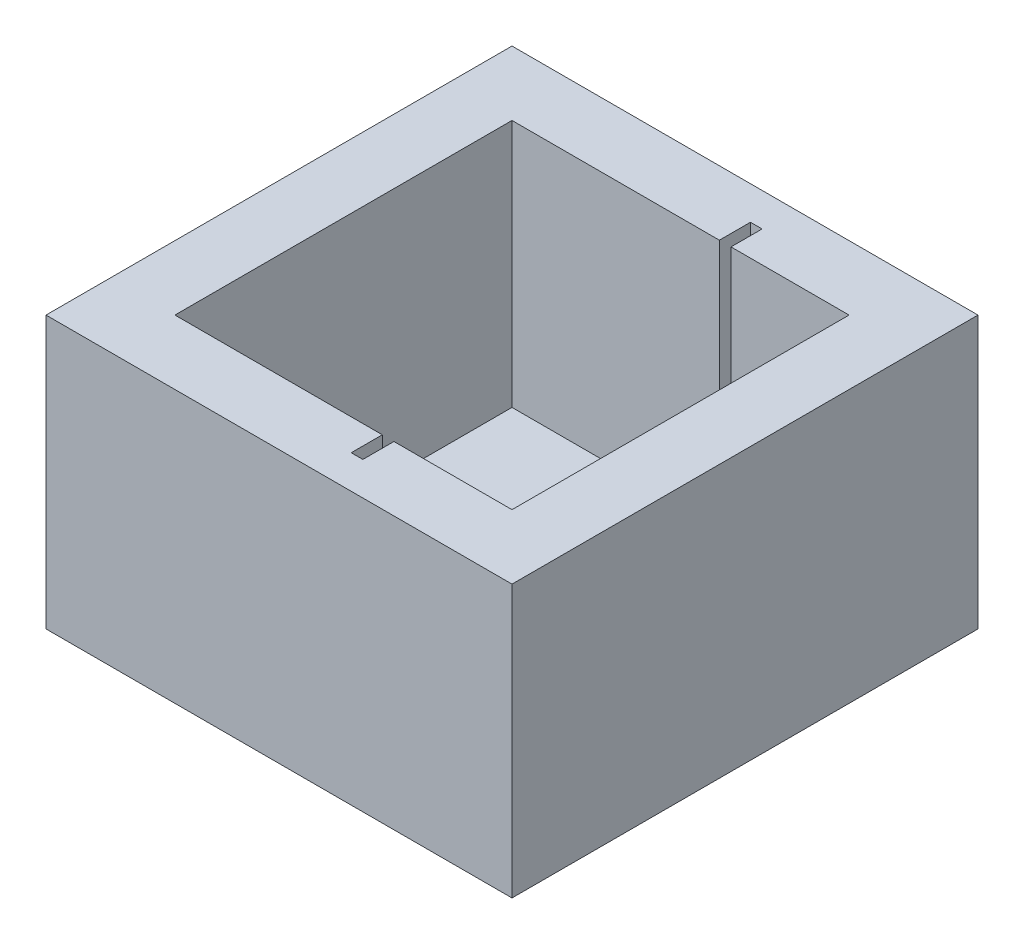
from build123d import *

# Parameters (mm, degrees)
SKETCH1_W           = 60
SKETCH1_H           = 60
BOSS_EXTRUDE1_DEPTH = 35
SKETCH2_W           = 43.4
SKETCH2_H           = 43.4
CUT_EXTRUDE1_DEPTH  = 32
SKETCH3_W           = 1.5
SKETCH3_H           = 4
CUT_EXTRUDE4_DEPTH  = 32
SKETCH7_W           = 3.5
SKETCH7_H           = 3.5
CUT_EXTRUDE7_DEPTH  = 76
BOSS_EXTRUDE4_DEPTH = 8.3
BOSS_EXTRUDE6_DEPTH = 8.3


with BuildPart() as part:
    # Sketch1 → Boss-Extrude1 (new body)
    with BuildSketch(Plane(origin=(0, 0, 0), x_dir=(1, 0, 0), z_dir=(0, 1, 0))):
        with Locations((-4.265402844, -11.303317536)):
            Rectangle(SKETCH1_W, SKETCH1_H)
    extrude(amount=BOSS_EXTRUDE1_DEPTH)

    # Sketch2 → Cut-Extrude1 (cut)
    with BuildSketch(Plane(origin=(0, 35, 0), x_dir=(1, 0, 0), z_dir=(0, 1, 0))):
        with Locations((-4.265402844, -11.303317536)):
            Rectangle(SKETCH2_W, SKETCH2_H)
    extrude(amount=-CUT_EXTRUDE1_DEPTH, mode=Mode.SUBTRACT)

    # Sketch3 → Cut-Extrude4 (cut)
    with BuildSketch(Plane(origin=(0, 3, 0), x_dir=(1, 0, 0), z_dir=(0, 1, 0))):
        with Locations((1.484597156, 12.396682464)):
            Rectangle(SKETCH3_W, SKETCH3_H)
        with Locations((1.484597156, -35.003317536)):
            Rectangle(SKETCH3_W, SKETCH3_H)
    extrude(amount=CUT_EXTRUDE4_DEPTH, mode=Mode.SUBTRACT)

    # Sketch7 → Cut-Extrude7 (cut)
    with BuildSketch(Plane.ZY.offset(34.265402844)):
        with Locations((-5.246682464, 30.75)):
            Rectangle(SKETCH7_W, SKETCH7_H)
    extrude(amount=-CUT_EXTRUDE7_DEPTH, mode=Mode.SUBTRACT)

    # Sketch9 → Boss-Extrude4 (add)
    with BuildSketch(Plane.ZY.offset(34.265402844)):
        Polygon((-6.996682464, 33.397625526), (-8.197769776, 33.397625526), (-8.197769776, 28.249822975), (-2.626030544, 28.249822975), (-2.626030544, 33.397625526), align=None)
    extrude(amount=-BOSS_EXTRUDE4_DEPTH)

    # Sketch10 → Boss-Extrude6 (add)
    with BuildSketch(Plane(origin=(25.734597156, 0, 0), x_dir=(0, 0, -1), z_dir=(1, 0, 0))):
        Polygon((3.496682464, 33.424191305), (7.449063177, 33.424191305), (7.449063177, 29.024449581), (7.449063177, 28.243284465), (2.654166816, 28.243284465), (2.654166816, 33.424191305), align=None)
    extrude(amount=-BOSS_EXTRUDE6_DEPTH)


solid = part.part
